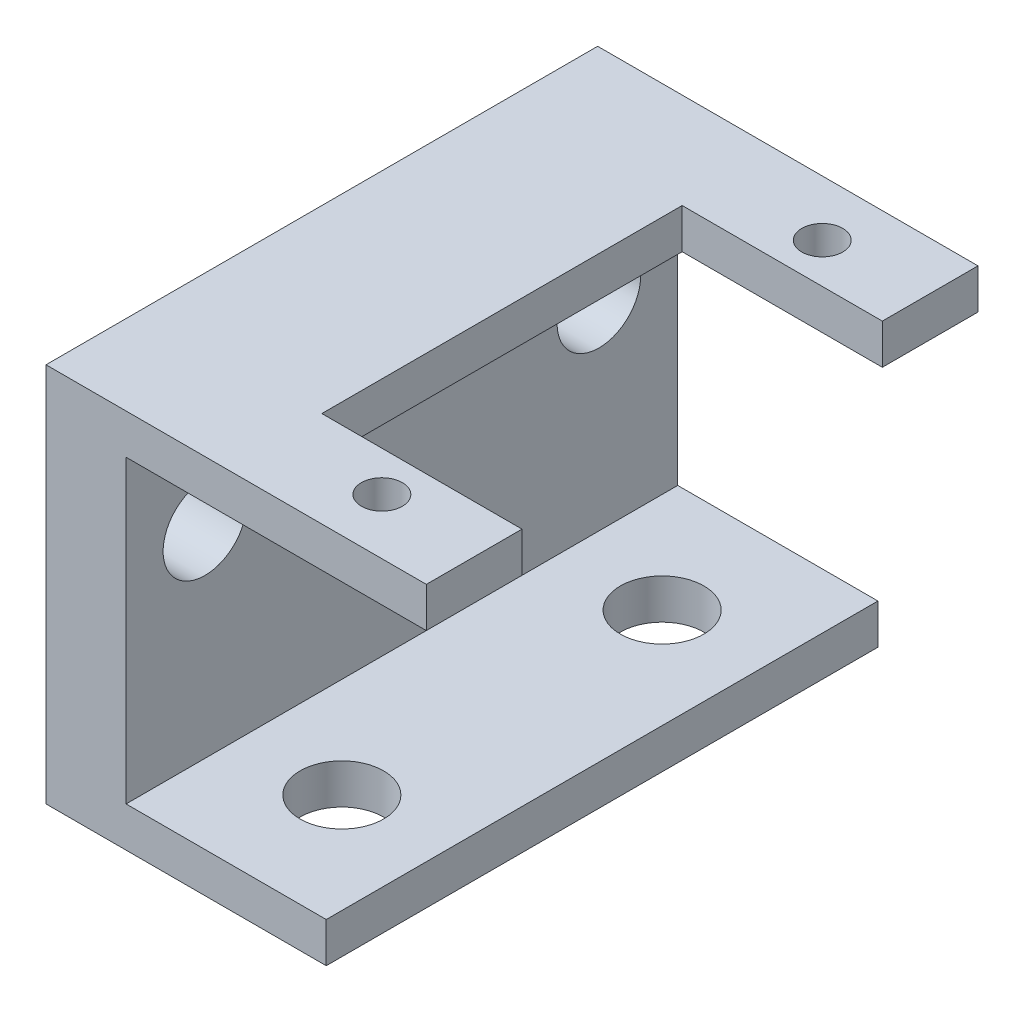
from build123d import *

# Parameters (mm, degrees)
SKETCH1_W                 = 5.08
SKETCH1_H                 = 19.05
BOSS_EXTRUDE1_DEPTH       = 35
F_5_0MM_DOWEL_HOLE1_D     = 5.3
F_5_0MM_DOWEL_HOLE2_D     = 5.3
F_5_0MM_DOWEL_HOLE2_DEPTH = 2.54
CUT_EXTRUDE1_REACH        = 50.883
SKETCH6_W                 = 12.7
SKETCH6_H                 = 22.86
M2_CLEARANCE_HOLE1_D      = 2.6
M2_CLEARANCE_HOLE1_DEPTH  = 2.54


with BuildPart() as part:
    # Sketch1 → Boss-Extrude1 (new body)
    with BuildSketch(Plane.XY):
        Polygon((0, 2.54), (0, 0), (17.78, 0), (17.78, 2.54), (5.08, 2.54), align=None)
        with Locations((2.54, 12.065)):
            Rectangle(SKETCH1_W, SKETCH1_H)
        Polygon((0, 24.13), (0, 21.59), (5.08, 21.59), (24.13, 21.59), (24.13, 24.13), align=None)
    extrude(amount=BOSS_EXTRUDE1_DEPTH)

    # Ø5.0mm Dowel Hole1 (through all)
    with Locations(Plane(origin=(5.08, 0, 0), x_dir=(0, 0, -1), z_dir=(1, 0, 0))):
        with Locations((-30, 15.24), (-5, 15.24)):
            Hole(F_5_0MM_DOWEL_HOLE1_D / 2)

    # Ø5.0mm Dowel Hole2
    with Locations(Plane(origin=(0, 2.54, 0), x_dir=(1, 0, 0), z_dir=(0, 1, 0))):
        with Locations((11.43, -27.66), (11.43, -7.34)):
            Hole(F_5_0MM_DOWEL_HOLE2_D / 2, depth=F_5_0MM_DOWEL_HOLE2_DEPTH)

    # Sketch6 → Cut-Extrude1 (cut, up to next)
    with BuildSketch(Plane(origin=(0, 24.13, 0), x_dir=(1, 0, 0), z_dir=(0, 1, 0)), mode=Mode.PRIVATE) as cut_extrude1_sk1:
        with Locations((17.78, -17.5)):
            Rectangle(SKETCH6_W, SKETCH6_H)
    cut_extrude1_tool1 = extrude(cut_extrude1_sk1.sketch, amount=-CUT_EXTRUDE1_REACH, mode=Mode.PRIVATE) & part.part
    add(cut_extrude1_tool1.solids().sort_by_distance((17.78, 24.13, 17.5))[0], mode=Mode.SUBTRACT)

    # M2 Clearance Hole1
    with Locations(Plane(origin=(0, 24.13, 0), x_dir=(1, 0, 0), z_dir=(0, 1, 0))):
        with Locations((17.78, -31.47), (17.78, -3.53)):
            Hole(M2_CLEARANCE_HOLE1_D / 2, depth=M2_CLEARANCE_HOLE1_DEPTH)


solid = part.part
